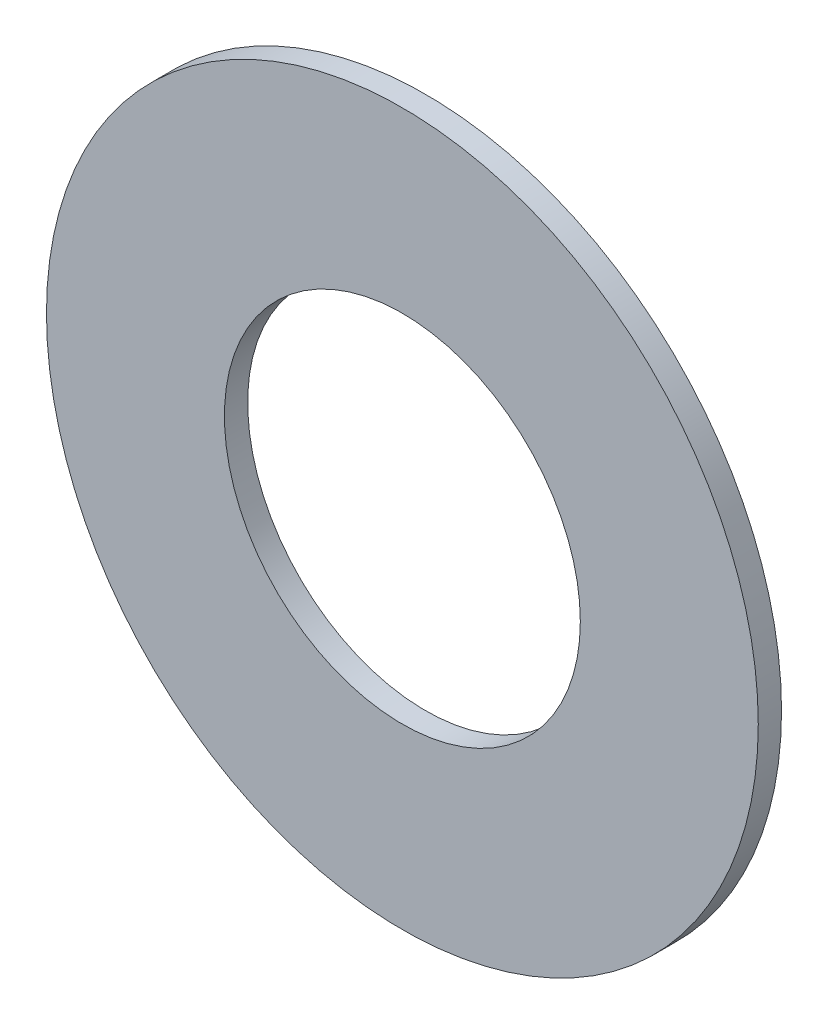
from build123d import *

# Parameters (mm, degrees)
SKETCH2_R           = 19.05
SKETCH2_R_2         = 9.525
BOSS_EXTRUDE1_DEPTH = 1.2446


with BuildPart() as part:
    # Sketch2 → Boss-Extrude1 (new body)
    with BuildSketch(Plane.XY):
        Circle(SKETCH2_R)
        Circle(SKETCH2_R_2, mode=Mode.SUBTRACT)
    extrude(amount=BOSS_EXTRUDE1_DEPTH)


solid = part.part
